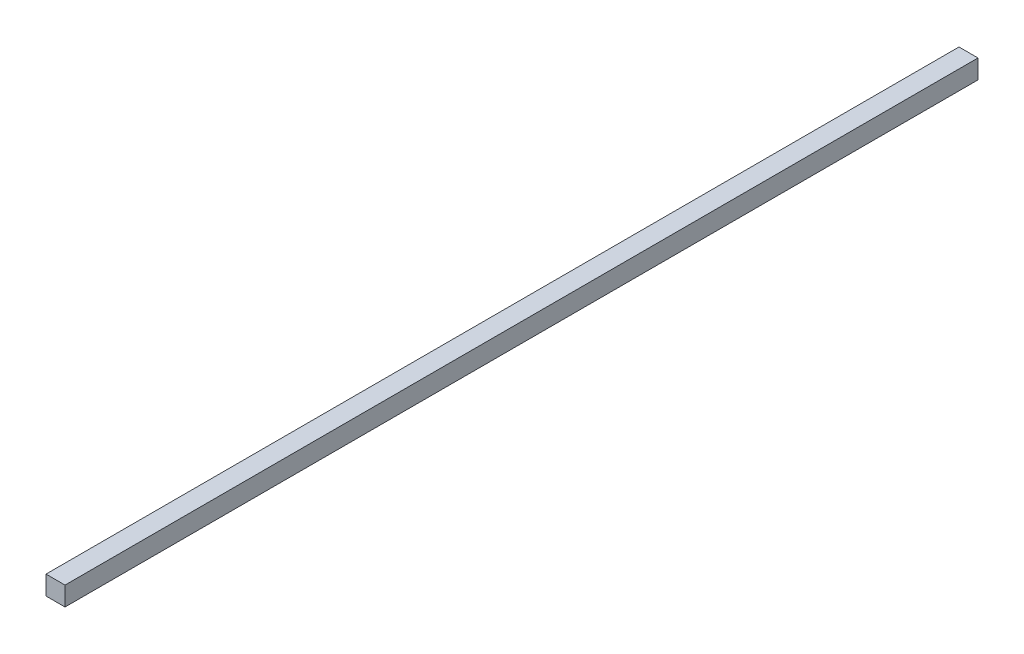
from build123d import *

# Parameters (mm, degrees)
SKETCH1_W           = 3.175
SKETCH1_H           = 3.175
BOSS_EXTRUDE1_DEPTH = 152.4


with BuildPart() as part:
    # Sketch1 → Boss-Extrude1 (new body)
    with BuildSketch(Plane.XY):
        Rectangle(SKETCH1_W, SKETCH1_H)
    extrude(amount=BOSS_EXTRUDE1_DEPTH)


solid = part.part
